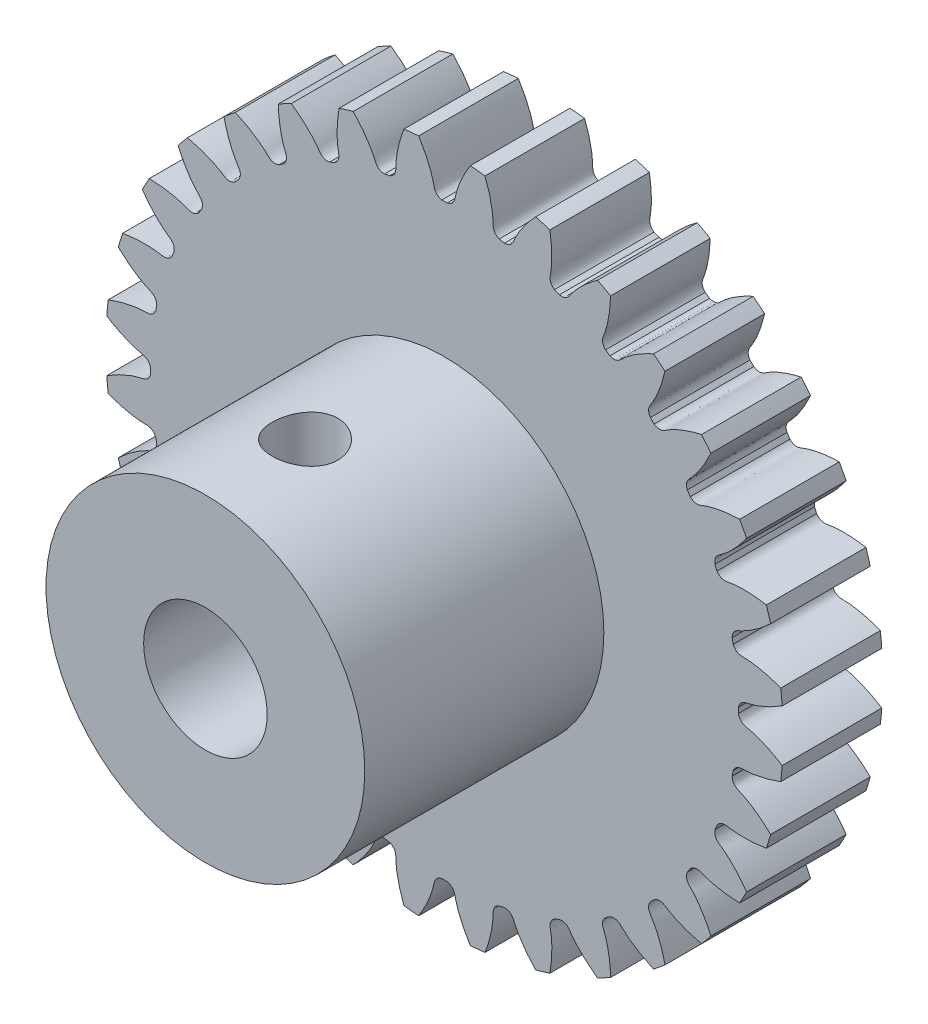
from build123d import *

# Parameters (mm, degrees)
SKETCH_1_R               = 8.5
EXTRUDE_1_DEPTH          = 2.5
CUT_EXTRUDE_1_DEPTH      = 13.278029158
PATTERN_CIRCULAR_1_COUNT = 32
SKETCH_5_R               = 4
EXTRUDE_2_DEPTH          = 6
CUT_EXTRUDE_2_REACH      = 16.694
SKETCH_4_R               = 1.55
CUT_EXTRUDE_3_REACH      = 16.694
SKETCH_6_R               = 0.825


with BuildPart() as part:
    # 草图1 → 凸台-拉伸1 (new body)
    with BuildSketch(Plane.XY):
        Circle(SKETCH_1_R)
    extrude(amount=EXTRUDE_1_DEPTH)

    # 草图2 → 切除-拉伸1 (cut, through all)
    with BuildSketch(Plane.XY):
        with BuildLine():
            ThreePointArc((0.067016057, 7.374695509), (0, 7.375), (-0.067016057, 7.374695509))
            add(Edge.make_bspline(
                [(-0.067016057, 7.374695509), (-0.244409752, 7.417585205), (-0.254185421, 7.546206625), (-0.286714327, 7.680381026), (-0.295183058, 7.71268082), (-0.305128683, 7.747692877), (-0.31664673, 7.785376713), (-0.32985255, 7.825680217), (-0.344853694, 7.868550436), (-0.361758143, 7.913930361), (-0.380671731, 7.961759942), (-0.401698795, 8.011975833), (-0.424941869, 8.064511528), (-0.450501667, 8.119297378), (-0.478476978, 8.176260642), (-0.508964584, 8.235325541), (-0.542059185, 8.296413305), (-0.577853311, 8.359442229), (-0.616437247, 8.424327727), (-0.657898954, 8.490982392), (-0.702323991, 8.559316051), (-0.749795443, 8.629235832), (-0.800393843, 8.700646224), (-0.854197106, 8.773449143), (-0.911280452, 8.847543999), (-0.971716342, 8.922827763), (-1.035574408, 8.999195043), (-1.102921392, 9.07653815), (-1.173821075, 9.154747175), (-1.248334222, 9.233710065), (-1.326518523, 9.313312698), (-1.40842851, 9.393438964), (-1.524138832, 9.502187768), (-1.614498649, 9.582084996), (-1.676516268, 9.63480345)],
                knots=[0, 0, 0, 0, 0.124532679, 0.135328735, 0.147193327, 0.160126453, 0.174128116, 0.189198313, 0.205337046, 0.222544314, 0.240820117, 0.260164456, 0.28057733, 0.302058739, 0.324608684, 0.348227164, 0.372914179, 0.39866973, 0.425493816, 0.453386438, 0.482347595, 0.512377287, 0.543475514, 0.575642277, 0.608877575, 0.643181408, 0.678553777, 0.714994681, 0.752504121, 0.791082096, 0.830728606, 0.871443651, 0.913227232, 1, 1, 1, 1], degree=3))
            ThreePointArc((-1.676516268, 9.63480345), (0, 9.779577922), (1.676516268, 9.63480345))
            add(Edge.make_bspline(
                [(0.067016057, 7.374695509), (0.244409752, 7.417585205), (0.254185421, 7.546206625), (0.286714327, 7.680381026), (0.295183058, 7.71268082), (0.305128683, 7.747692877), (0.31664673, 7.785376713), (0.32985255, 7.825680217), (0.344853694, 7.868550436), (0.361758143, 7.913930361), (0.380671731, 7.961759942), (0.401698795, 8.011975833), (0.424941869, 8.064511528), (0.450501667, 8.119297378), (0.478476978, 8.176260642), (0.508964584, 8.235325541), (0.542059185, 8.296413305), (0.577853311, 8.359442229), (0.616437247, 8.424327727), (0.657898954, 8.490982392), (0.702323991, 8.559316051), (0.749795443, 8.629235832), (0.800393843, 8.700646224), (0.854197106, 8.773449143), (0.911280452, 8.847543999), (0.971716342, 8.922827763), (1.035574408, 8.999195043), (1.102921392, 9.07653815), (1.173821075, 9.154747175), (1.248334222, 9.233710065), (1.326518523, 9.313312698), (1.40842851, 9.393438964), (1.524138832, 9.502187768), (1.614498649, 9.582084996), (1.676516268, 9.63480345)],
                knots=[0, 0, 0, 0, 0.124532679, 0.135328735, 0.147193327, 0.160126453, 0.174128116, 0.189198313, 0.205337046, 0.222544314, 0.240820117, 0.260164456, 0.28057733, 0.302058739, 0.324608684, 0.348227164, 0.372914179, 0.39866973, 0.425493816, 0.453386438, 0.482347595, 0.512377287, 0.543475514, 0.575642277, 0.608877575, 0.643181408, 0.678553777, 0.714994681, 0.752504121, 0.791082096, 0.830728606, 0.871443651, 0.913227232, 1, 1, 1, 1], degree=3))
        make_face()
    cut_extrude_1 = extrude(amount=CUT_EXTRUDE_1_DEPTH, mode=Mode.SUBTRACT)

    # 阵列(圆周)1: 切除-拉伸1 ×32 about axis
    pattern_circular_1_axis = Axis((0, 0, 2.5), (0, 0, -1))
    for i in range(1, PATTERN_CIRCULAR_1_COUNT):
        add(cut_extrude_1.rotate(pattern_circular_1_axis, i * 360 / PATTERN_CIRCULAR_1_COUNT), mode=Mode.SUBTRACT)

    # 草图5 → 凸台-拉伸2 (add)
    with BuildSketch(Plane.XY.offset(2.5)):
        Circle(SKETCH_5_R)
    extrude(amount=EXTRUDE_2_DEPTH)

    # 草图4 → 切除-拉伸2 (cut, up to next)
    with BuildSketch(Plane(origin=(0, 0, 0), x_dir=(-1, 0, 0), z_dir=(0, 0, -1)), mode=Mode.PRIVATE) as cut_extrude_2_sk1:
        Circle(SKETCH_4_R)
    cut_extrude_2_tool1 = extrude(cut_extrude_2_sk1.sketch, amount=-CUT_EXTRUDE_2_REACH, mode=Mode.PRIVATE) & part.part
    add(cut_extrude_2_tool1.solids().sort_by_distance((0, 0, 0))[0], mode=Mode.SUBTRACT)

    # 草图6 → 切除-拉伸3 (cut, up to next)
    with BuildSketch(Plane(origin=(0, 0, 0), x_dir=(1, 0, 0), z_dir=(0, 1, 0)), mode=Mode.PRIVATE) as cut_extrude_3_sk1:
        with Locations((0, -6)):
            Circle(SKETCH_6_R)
    cut_extrude_3_tool1 = extrude(cut_extrude_3_sk1.sketch, amount=CUT_EXTRUDE_3_REACH, mode=Mode.PRIVATE) & part.part
    add(cut_extrude_3_tool1.solids().sort_by_distance((0, 0, 6))[0], mode=Mode.SUBTRACT)


solid = part.part
